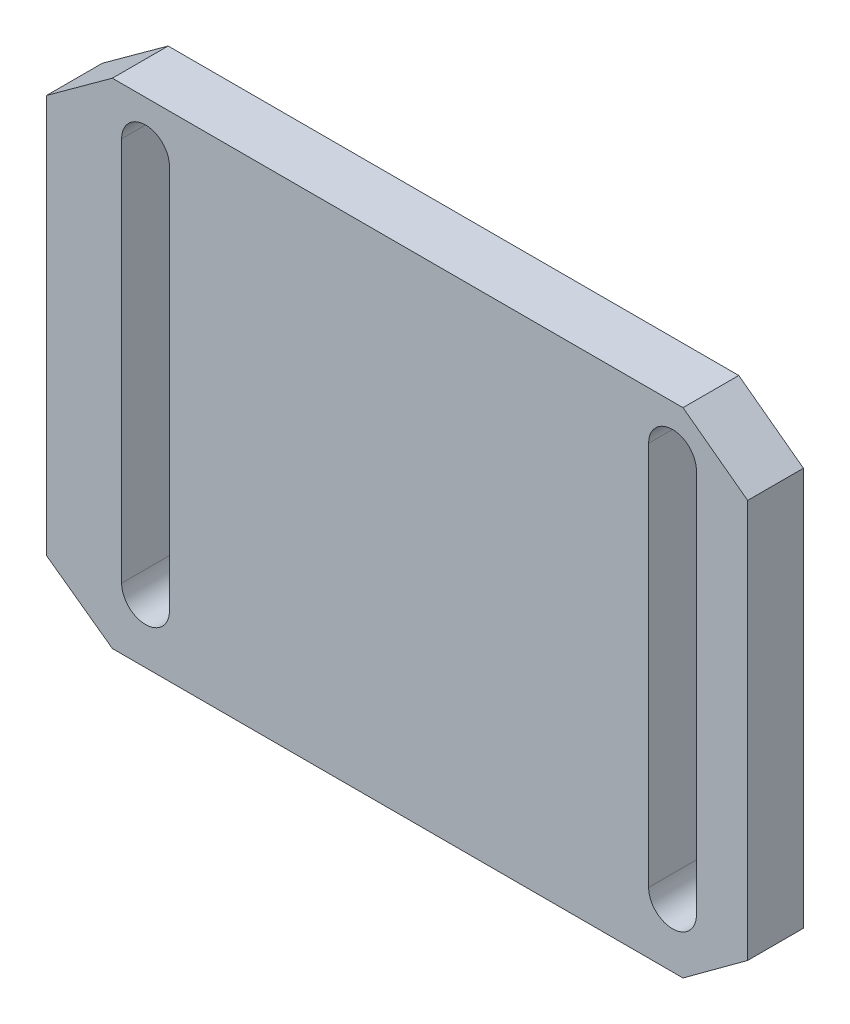
from build123d import *

# Parameters (mm, degrees)
BOSS_EXTRUDE1_DEPTH = 7000


with BuildPart() as part:
    # Sketch1 → Boss-Extrude1 (new body)
    with BuildSketch(Plane.XY):
        Polygon((-79740.527004551, 61993.913364055), (-8114.145758192, 61993.913364055), (2.575115207, 55969.074099511), (2.575115207, 5957.074352856), (-8114.145758192, -6.086635945), (-79740.527004551, -6.086635945), (-87997.424884793, 5957.074352856), (-87997.424884793, 55993.913364055), align=None)
        with BuildLine():
            Line((-72575.73242965, 55993.913364055), (-72575.73242965, 7685.319886443))
            ThreePointArc((-72575.73242965, 7685.319886443), (-75575.73242965, 4685.319886443), (-78575.73242965, 7685.319886443))
            Line((-78575.73242965, 7685.319886443), (-78575.73242965, 55993.913364055))
            ThreePointArc((-78575.73242965, 55993.913364055), (-75575.73242965, 58993.913364055), (-72575.73242965, 55993.913364055))
        make_face(mode=Mode.SUBTRACT)
        with BuildLine():
            Line((-6427.339306355, 55969.074099511), (-6427.339306355, 7685.319886443))
            ThreePointArc((-6427.339306355, 7685.319886443), (-9427.339306355, 4685.319886443), (-12427.339306355, 7685.319886443))
            Line((-12427.339306355, 7685.319886443), (-12427.339306355, 55969.074099511))
            ThreePointArc((-12427.339306355, 55969.074099511), (-9427.339306355, 58969.074099511), (-6427.339306355, 55969.074099511))
        make_face(mode=Mode.SUBTRACT)
    extrude(amount=BOSS_EXTRUDE1_DEPTH)


solid = part.part
